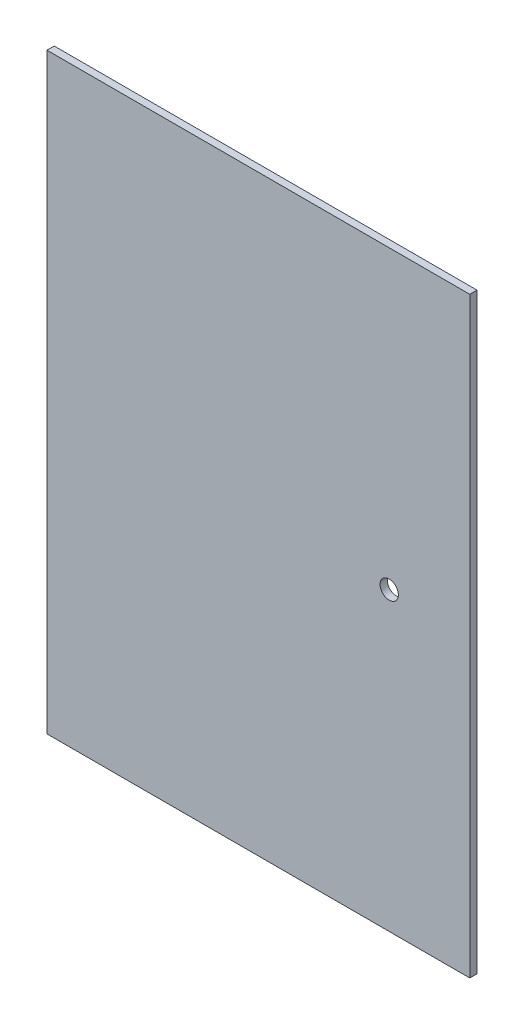
from build123d import *

# Parameters (mm, degrees)
SKETCH1_W           = 467
SKETCH1_H           = 654
SKETCH1_R           = 10.1
BOSS_EXTRUDE1_DEPTH = 8


with BuildPart() as part:
    # Sketch1 → Boss-Extrude1 (new body)
    with BuildSketch(Plane.XY.offset(8)):
        Rectangle(SKETCH1_W, SKETCH1_H)
        with Locations(Location((144.5, 0, 0), (0, 0, 180))):
            Circle(SKETCH1_R, mode=Mode.SUBTRACT)
    extrude(amount=-BOSS_EXTRUDE1_DEPTH)


solid = part.part
